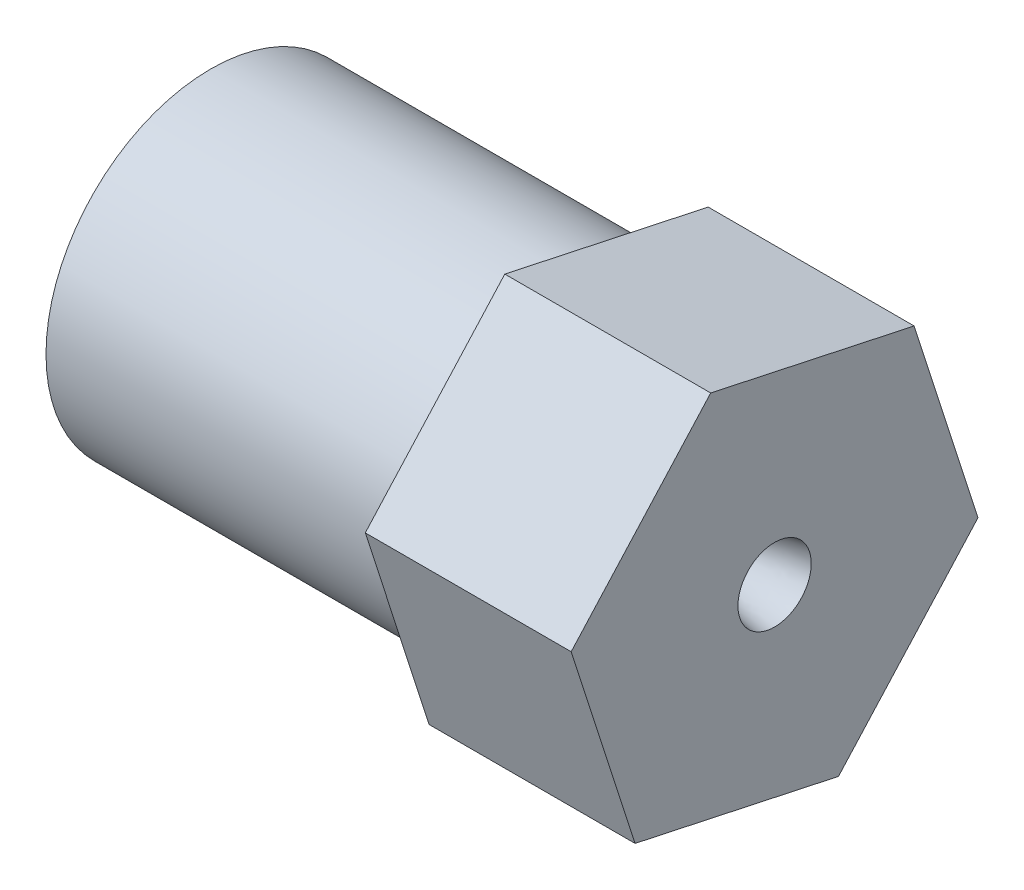
from build123d import *

# Parameters (mm, degrees)
SKETCH4_R           = 10.16
BOSS_EXTRUDE1_DEPTH = 12.7
FILLET1_R           = 0.635


with BuildPart() as part:
    # Sketch1 → Revolve1 (revolve)
    with BuildSketch(Plane.XY, mode=Mode.PRIVATE) as revolve1_sk:
        with BuildLine():
            Line((-1.616446102, 2.193553898), (-2.937956234, 3.51506403))
            ThreePointArc((-2.937956234, 3.51506403), (-3.968000366, 4.203317516), (-5.183020264, 4.445))
            Line((-5.183020264, 4.445), (-13.462, 4.445))
            Line((-13.462, 4.445), (-13.462, 4.699))
            ThreePointArc((-13.462, 4.699), (-13.499197439, 4.788802561), (-13.589, 4.826))
            Line((-13.589, 4.826), (-19.304, 4.826))
            ThreePointArc((-19.304, 4.826), (-19.753012806, 5.011987194), (-19.939, 5.461))
            Line((-19.939, 5.461), (-19.939, 6.8199))
            ThreePointArc((-19.939, 6.8199), (-19.976197439, 6.909702561), (-20.066, 6.9469))
            Line((-20.066, 6.9469), (-24.892, 6.9469))
            Line((-24.892, 6.9469), (-24.892, 7.8994))
            ThreePointArc((-24.892, 7.8994), (-24.929197439, 7.989202561), (-25.019, 8.0264))
            Line((-25.019, 8.0264), (-31.115, 8.0264))
            ThreePointArc((-31.115, 8.0264), (-31.564012806, 8.212387194), (-31.75, 8.6614))
            Line((-31.75, 8.6614), (-31.75, 10.16))
            Line((-31.75, 10.16), (-9.671239617, 10.16))
            Line((-9.671239617, 10.16), (3.028760383, 10.16))
            Line((3.028760383, 10.16), (3.028760383, 2.260457299))
            add(Edge.make_bspline(
                [(3.028760383, 2.260457299), (1.566112415, 2.054895533), (0.208495479, 1.560763378)],
                knots=[0, 0, 0, 1, 1, 1], degree=2))
            ThreePointArc((0.208495479, 1.560763378), (0.105855929, 1.533261194), (0, 1.524))
            ThreePointArc((0, 1.524), (-0.874814326, 1.698011389), (-1.616446102, 2.193553898))
        make_face()
    revolve(revolve1_sk.sketch.rotate(Axis((0, 0, 0), (1, 0, 0)), 90), axis=Axis((0, 0, 0), (1, 0, 0)))

    # Sketch4 → Boss-Extrude1 (add)
    with BuildSketch(Plane(origin=(3.028760383, 0, 0), x_dir=(0, 0, -1), z_dir=(1, 0, 0))):
        Polygon((3.940411868, -12.211607701), (12.545768424, -2.693307071), (8.605356556, 9.51830063), (-3.940411868, 12.211607701), (-12.545768424, 2.693307071), (-8.605356556, -9.51830063), align=None)
        with Locations(Location((0, 0, 0), (0, 0, 180))):
            Circle(SKETCH4_R, mode=Mode.SUBTRACT)
    extrude(amount=-BOSS_EXTRUDE1_DEPTH)

    # Fillet1
    fillet1_edges = [part.edges().sort_by_distance(p)[0] for p in [
        (-9.671239617, 0, -10.16),
    ]]
    fillet(fillet1_edges, radius=FILLET1_R)


solid = part.part
